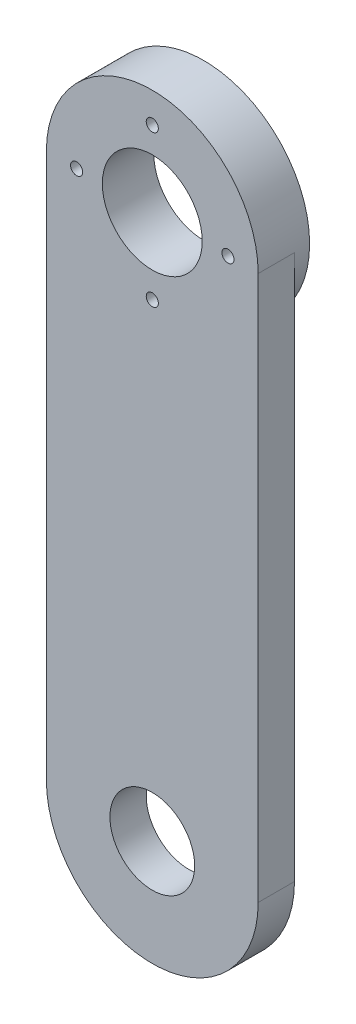
from build123d import *
from build123d.topology import SkipClean

# Parameters (mm, degrees)
SKETCH2_R           = 16.5
SKETCH2_R_2         = 14
SKETCH2_R_3         = 2
BOSS_EXTRUDE1_DEPTH = 12
BOSS_EXTRUDE2_START = 5
SKETCH3_R           = 2
SKETCH3_R_2         = 16.5
BOSS_EXTRUDE2_DEPTH = 5


with BuildPart() as part:
    # Sketch2 → Boss-Extrude1 (new body)
    with BuildSketch(Plane.XY):
        with BuildLine():
            Line((35, 53.138686131), (35, -126.861313869))
            ThreePointArc((35, -126.861313869), (0, -161.861313869), (-35, -126.861313869))
            Line((-35, -126.861313869), (-35, 53.138686131))
            ThreePointArc((-35, 53.138686131), (0, 88.138686131), (35, 53.138686131))
        make_face()
        with Locations((0, 53.138686131)):
            Circle(SKETCH2_R, mode=Mode.SUBTRACT)
        with Locations((0, -126.861313869)):
            Circle(SKETCH2_R_2, mode=Mode.SUBTRACT)
        with Locations((0, 78.138686131)):
            Circle(SKETCH2_R_3, mode=Mode.SUBTRACT)
        with Locations((-25, 53.138686131)):
            Circle(SKETCH2_R_3, mode=Mode.SUBTRACT)
        with Locations((0, 28.138686131)):
            Circle(SKETCH2_R_3, mode=Mode.SUBTRACT)
        with Locations((25, 53.138686131)):
            Circle(SKETCH2_R_3, mode=Mode.SUBTRACT)
    extrude(amount=BOSS_EXTRUDE1_DEPTH)

    # Sketch3 → Boss-Extrude2 (add)
    with SkipClean():  # the faces are left unmerged after this step: merging them gives an invalid solid
        with BuildSketch(Plane(origin=(0, 0, 0), x_dir=(-1, 0, 0), z_dir=(0, 0, -1)).offset(BOSS_EXTRUDE2_START)):
            with BuildLine():
                ThreePointArc((35, 53.138686131), (0, 88.138686131), (-35, 53.138686131))
                ThreePointArc((-35, 53.138686131), (0, 18.138686131), (35, 53.138686131))
            make_face()
            with Locations((-25, 53.138686131)):
                Circle(SKETCH3_R, mode=Mode.SUBTRACT)
            with Locations((0, 28.138686131)):
                Circle(SKETCH3_R, mode=Mode.SUBTRACT)
            with Locations((0, 53.138686131)):
                Circle(SKETCH3_R_2, mode=Mode.SUBTRACT)
            with Locations((0, 78.138686131)):
                Circle(SKETCH3_R, mode=Mode.SUBTRACT)
            with Locations((25, 53.138686131)):
                Circle(SKETCH3_R, mode=Mode.SUBTRACT)
        extrude(amount=-BOSS_EXTRUDE2_DEPTH)


solid = part.part
